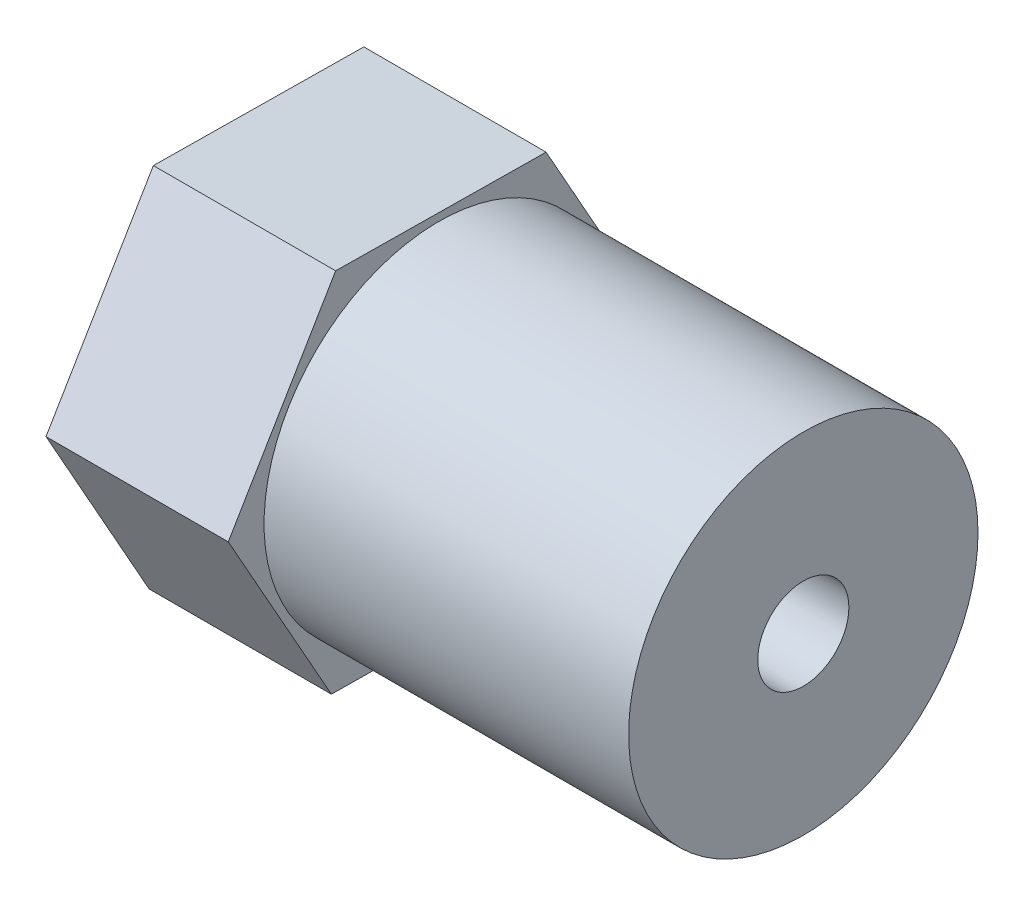
from build123d import *

# Parameters (mm, degrees)
BOSS_EXTRUDE1_DEPTH = 6
SKETCH2_R           = 2
CUT_EXTRUDE1_DEPTH  = 6
SKETCH3_R           = 5.75
SKETCH3_R_2         = 1.5
BOSS_EXTRUDE2_DEPTH = 12


with BuildPart() as part:
    # Sketch1 → Boss-Extrude1 (new body)
    with BuildSketch(Plane(origin=(0, 0, 0), x_dir=(0, 0, -1), z_dir=(1, 0, 0))):
        Polygon((3.393898061, -6.039988075), (6.927732142, -0.080792099), (3.533834081, 5.959195977), (-3.393898061, 6.039988075), (-6.927732142, 0.080792099), (-3.533834081, -5.959195977), align=None)
    extrude(amount=BOSS_EXTRUDE1_DEPTH)

    # Sketch2 → Cut-Extrude1 (cut)
    with BuildSketch(Plane(origin=(6, 0, 0), x_dir=(0, 0, -1), z_dir=(1, 0, 0))):
        Circle(SKETCH2_R)
    extrude(amount=-CUT_EXTRUDE1_DEPTH, mode=Mode.SUBTRACT)

    # Sketch3 → Boss-Extrude2 (add)
    with BuildSketch(Plane(origin=(6, 0, 0), x_dir=(0, 0, -1), z_dir=(1, 0, 0))):
        Circle(SKETCH3_R)
        Circle(SKETCH3_R_2, mode=Mode.SUBTRACT)
    extrude(amount=BOSS_EXTRUDE2_DEPTH)


solid = part.part
